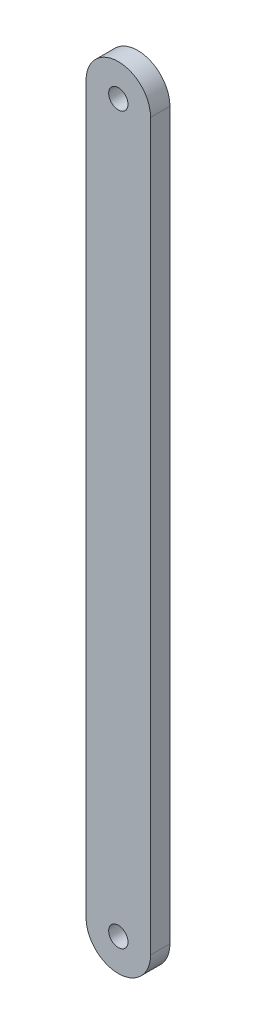
from build123d import *

# Parameters (mm, degrees)
BOSS_EXTRUDE1_DEPTH = 6
SKETCH2_R           = 3
CUT_EXTRUDE1_DEPTH  = 236.289183772


with BuildPart() as part:
    # Sketch1 → Boss-Extrude1 (new body)
    with BuildSketch(Plane.XY):
        with BuildLine():
            Line((-10, 0), (-10, 225))
            ThreePointArc((-10, 225), (0, 235), (10, 225))
            Line((10, 225), (10, 0))
            ThreePointArc((10, 0), (0, -10), (-10, 0))
        make_face()
    extrude(amount=BOSS_EXTRUDE1_DEPTH)

    # Sketch2 → Cut-Extrude1 (cut, through all)
    with BuildSketch(Plane.XY.offset(6)):
        with Locations((0, 225)):
            Circle(SKETCH2_R)
        Circle(SKETCH2_R)
    extrude(amount=-CUT_EXTRUDE1_DEPTH, mode=Mode.SUBTRACT)


solid = part.part
